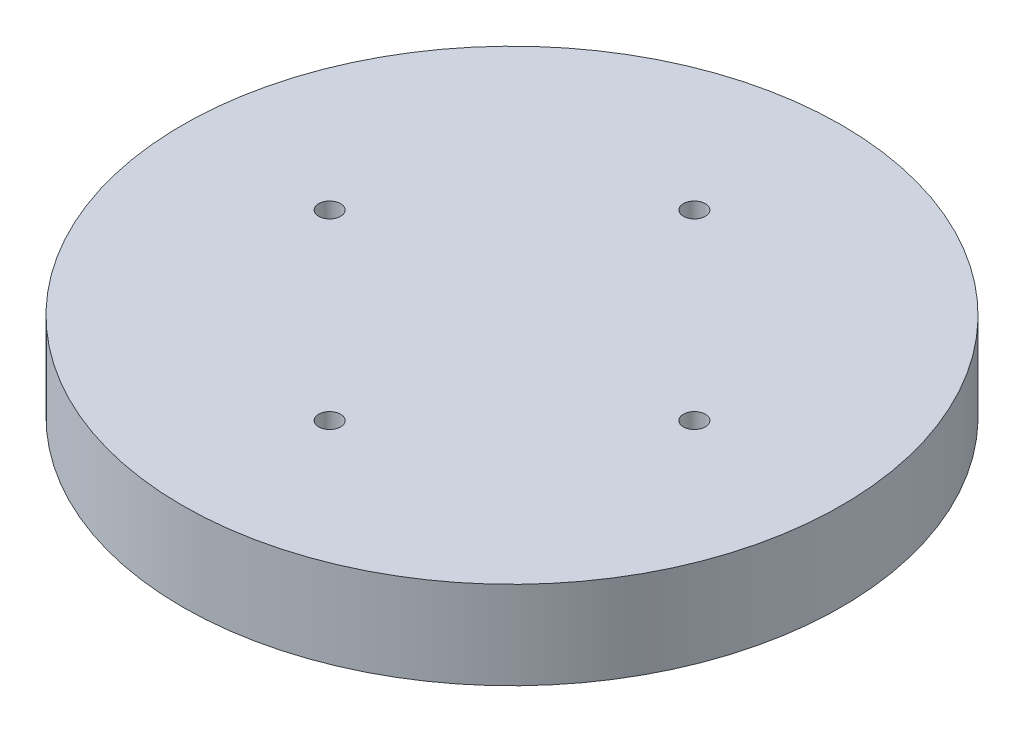
from build123d import *

# Parameters (mm, degrees)
SKETCH1_R           = 75
BOSS_EXTRUDE1_DEPTH = 20
CUT_EXTRUDE1_REACH  = 109.935
SKETCH2_R           = 2.5


with BuildPart() as part:
    # Sketch1 → Boss-Extrude1 (new body)
    with BuildSketch(Plane(origin=(0, 0, 0), x_dir=(1, 0, 0), z_dir=(0, 1, 0))):
        with Locations(Location((0, 0, 0), (0, 0, 270))):
            Circle(SKETCH1_R)
    extrude(amount=BOSS_EXTRUDE1_DEPTH)

    # Sketch2 → Cut-Extrude1 (cut, up to next)
    with BuildSketch(Plane(origin=(0, 20, 0), x_dir=(1, 0, 0), z_dir=(0, 1, 0)), mode=Mode.PRIVATE) as cut_extrude1_sk1:
        with Locations(Location((0, 41.5, 0), (0, 0, 270))):
            Circle(SKETCH2_R)
    cut_extrude1_tool1 = extrude(cut_extrude1_sk1.sketch, amount=-CUT_EXTRUDE1_REACH, mode=Mode.PRIVATE) & part.part
    # Sketch2 → Cut-Extrude1 (cut, up to next)
    with BuildSketch(Plane(origin=(0, 20, 0), x_dir=(1, 0, 0), z_dir=(0, 1, 0)), mode=Mode.PRIVATE) as cut_extrude1_sk2:
        with Locations(Location((41.5, 0, 0), (0, 0, 270))):
            Circle(SKETCH2_R)
    cut_extrude1_tool2 = extrude(cut_extrude1_sk2.sketch, amount=-CUT_EXTRUDE1_REACH, mode=Mode.PRIVATE) & part.part
    # Sketch2 → Cut-Extrude1 (cut, up to next)
    with BuildSketch(Plane(origin=(0, 20, 0), x_dir=(1, 0, 0), z_dir=(0, 1, 0)), mode=Mode.PRIVATE) as cut_extrude1_sk3:
        with Locations(Location((0, -41.5, 0), (0, 0, 270))):
            Circle(SKETCH2_R)
    cut_extrude1_tool3 = extrude(cut_extrude1_sk3.sketch, amount=-CUT_EXTRUDE1_REACH, mode=Mode.PRIVATE) & part.part
    # Sketch2 → Cut-Extrude1 (cut, up to next)
    with BuildSketch(Plane(origin=(0, 20, 0), x_dir=(1, 0, 0), z_dir=(0, 1, 0)), mode=Mode.PRIVATE) as cut_extrude1_sk4:
        with Locations(Location((-41.5, 0, 0), (0, 0, 270))):
            Circle(SKETCH2_R)
    cut_extrude1_tool4 = extrude(cut_extrude1_sk4.sketch, amount=-CUT_EXTRUDE1_REACH, mode=Mode.PRIVATE) & part.part
    add(cut_extrude1_tool1.solids().sort_by_distance((0, 20, -41.5))[0], mode=Mode.SUBTRACT)
    add(cut_extrude1_tool2.solids().sort_by_distance((41.5, 20, 0))[0], mode=Mode.SUBTRACT)
    add(cut_extrude1_tool3.solids().sort_by_distance((0, 20, 41.5))[0], mode=Mode.SUBTRACT)
    add(cut_extrude1_tool4.solids().sort_by_distance((-41.5, 20, 0))[0], mode=Mode.SUBTRACT)


solid = part.part
